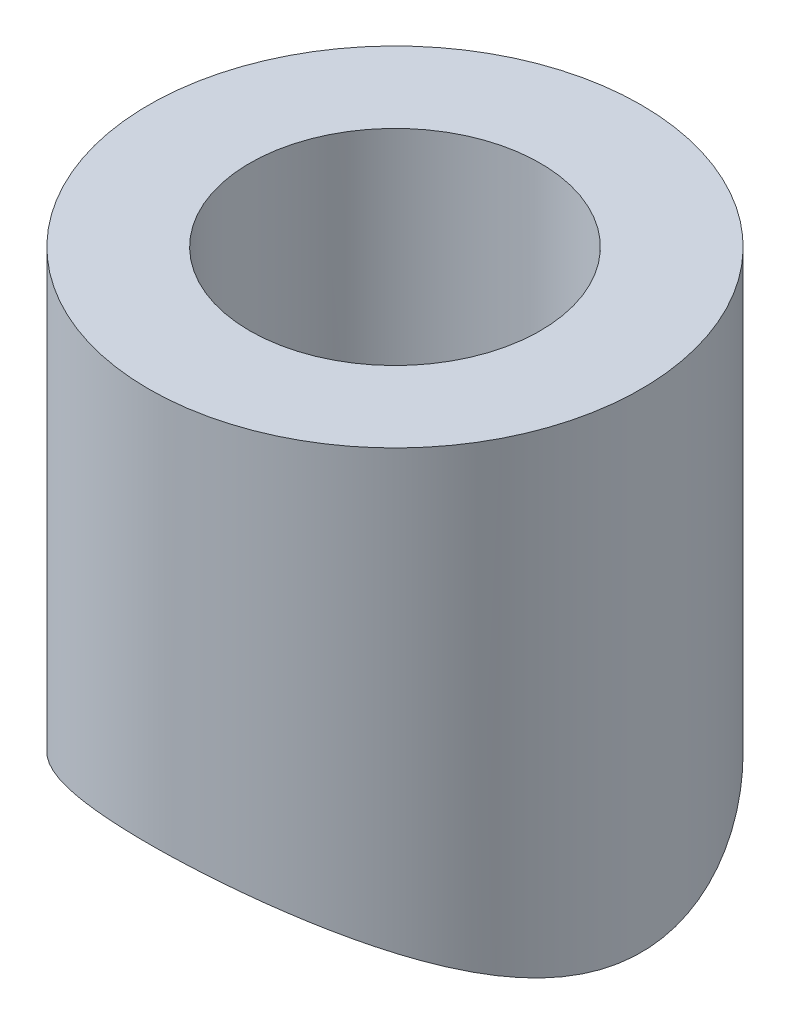
from build123d import *

# Parameters (mm, degrees)
SKETCH1_R               = 10
BOSS_EXTRUDE1_DEPTH     = 20
CUT_EXTRUDE1_DEPTH      = 25.494897428
CUT_EXTRUDE1_DEPTH_BACK = 25.494897428
SKETCH2_R               = 15
G1_4_TAPPED_HOLE1_D     = 11.8


with BuildPart() as part:
    # Sketch1 → Boss-Extrude1 (new body)
    with BuildSketch(Plane(origin=(0, 0, 0), x_dir=(1, 0, 0), z_dir=(0, 1, 0))):
        with Locations(Location((0, 0, 0), (0, 0, 270))):
            Circle(SKETCH1_R)
    extrude(amount=BOSS_EXTRUDE1_DEPTH)

    # Sketch2 → Cut-Extrude1 (cut, two sides: drawn at the far end of the back side and taken through both)
    with BuildSketch(Plane.XY.offset(-CUT_EXTRUDE1_DEPTH_BACK)):
        with Locations((0, -11)):
            Circle(SKETCH2_R)
    extrude(amount=CUT_EXTRUDE1_DEPTH + CUT_EXTRUDE1_DEPTH_BACK, mode=Mode.SUBTRACT)

    # G1/4 Tapped Hole1 (through all)
    with Locations(Plane(origin=(0, 20, 0), x_dir=(1, 0, 0), z_dir=(0, 1, 0))):
        with Locations((0, 0)):
            Hole(G1_4_TAPPED_HOLE1_D / 2)


solid = part.part
